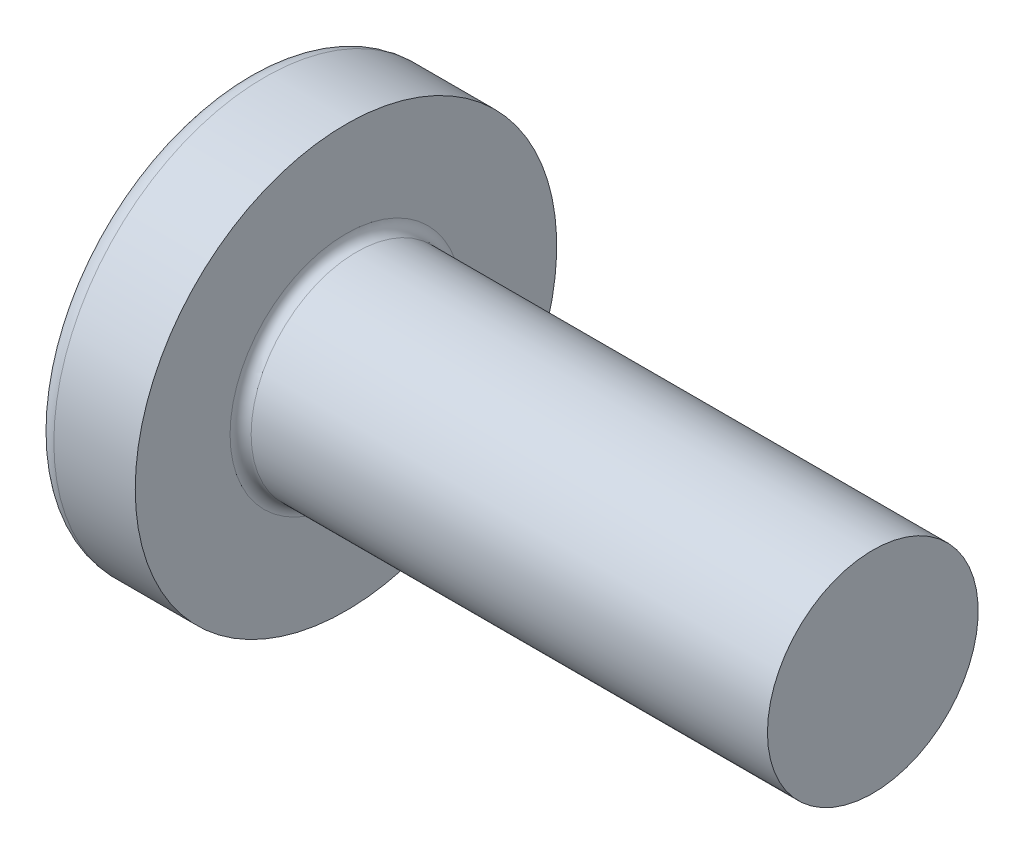
from build123d import *

# Parameters (mm, degrees)
FILLET1_R    = 0.2
RECPAT_COUNT = 2
RECPAT_ANGLE = 90


with BuildPart() as part:
    # BodySke → Base-Revolve (revolve)
    with BuildSketch(Plane.XY, mode=Mode.PRIVATE) as base_revolve_sk:
        with BuildLine():
            Line((3.1, 2), (3.1, 4))
            Line((3.1, 4), (1.555305874, 4))
            ThreePointArc((1.555305874, 4), (1.392873227, 3.961271902), (1.265388955, 3.853420195))
            ThreePointArc((1.265388955, 3.853420195), (0.324444487, 2.027933456), (0, 0))
            Line((0, 0), (13.1, 0))
            Line((13.1, 0), (13.1, 2))
            Line((13.1, 2), (3.1, 2))
        make_face()
    revolve(base_revolve_sk.sketch.rotate(Axis((-25.4, 0, 0), (1, 0, 0)), 90), axis=Axis((-25.4, 0, 0), (1, 0, 0)))

    # Fillet1
    fillet1_edges = [part.edges().sort_by_distance(p)[0] for p in [
        (3.1, 0, -2),
    ]]
    fillet(fillet1_edges, radius=FILLET1_R)

    # Sketch3 → Recess section 0
    with BuildSketch(Plane(origin=(0, 0, 0), x_dir=(0, 0, -1), z_dir=(1, 0, 0))):
        with BuildLine():
            Line((0.515, -2.15), (-0.515, -2.15))
            Line((-0.515, -2.15), (-0.515, 2.15))
            Line((-0.515, 2.15), (0.515, 2.15))
            Line((0.515, 2.15), (0.515, -2.15))
        make_face()
    # Sketch4 → Recess section 1
    with BuildSketch(Plane(origin=(2.34, 0, 0), x_dir=(0, 0, -1), z_dir=(1, 0, 0))):
        with BuildLine():
            Line((0.515, -0.983319077), (-0.515, -0.983319077))
            Line((-0.515, -0.983319077), (-0.515, 0.983319077))
            Line((-0.515, 0.983319077), (0.515, 0.983319077))
            Line((0.515, 0.983319077), (0.515, -0.983319077))
        make_face()
    recess = loft(mode=Mode.SUBTRACT)

    # RecPat: Recess ×2 about axis
    recpat_axis = Axis((-25.4, 0, 0), (1, 0, 0))
    for i in range(1, RECPAT_COUNT):
        add(recess.rotate(recpat_axis, i * RECPAT_ANGLE / (RECPAT_COUNT - 1)), mode=Mode.SUBTRACT)

    # RecCorSke → RecessCore (revolve, cut)
    with BuildSketch(Plane.XY, mode=Mode.PRIVATE) as recesscore_sk:
        Polygon((0, 0), (0, 1.01462874), (2.34, 0.851), (2.616506661, 0), align=None)
    revolve(recesscore_sk.sketch.rotate(Axis((-3.175, 0, 0), (1, 0, 0)), 345.452408108), axis=Axis((-3.175, 0, 0), (1, 0, 0)), mode=Mode.SUBTRACT)


solid = part.part
